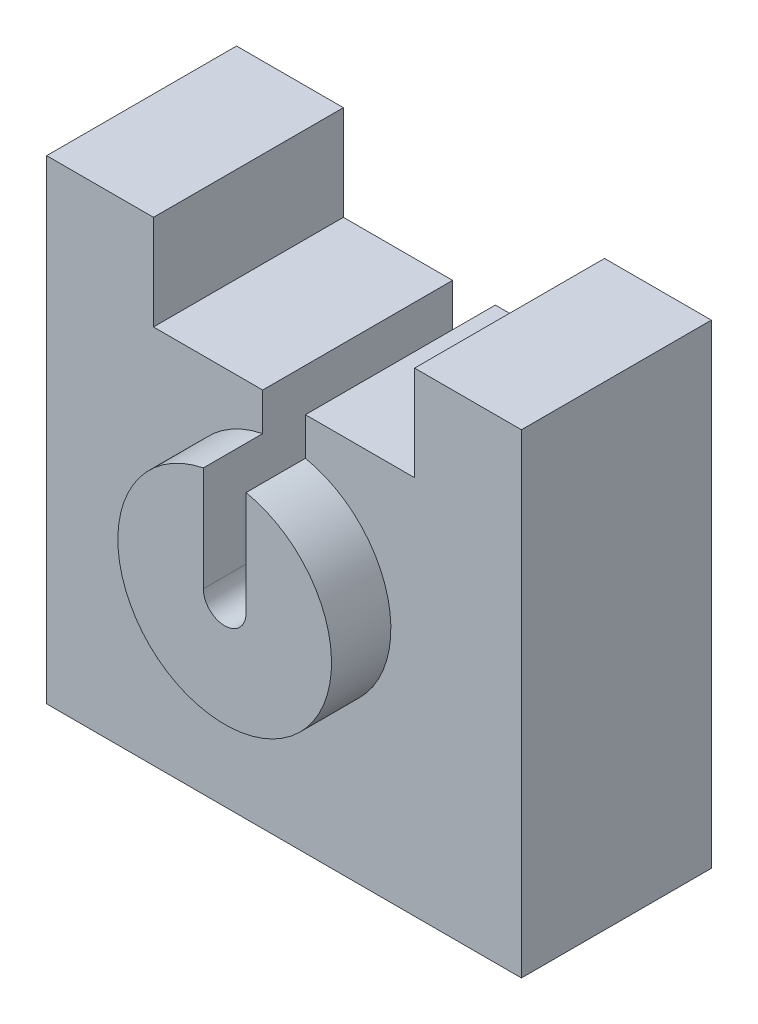
from build123d import *

# Parameters (mm, degrees)
BOSS_EXTRUDE1_DEPTH = 0.4
SKETCH2_R           = 0.225
BOSS_EXTRUDE2_DEPTH = 0.525
SKETCH3_R           = 0.045
CUT_EXTRUDE1_DEPTH  = 1.880695748
SKETCH5_W           = 0.09
SKETCH5_H           = 0.5
CUT_EXTRUDE2_DEPTH  = 1.880695748


with BuildPart() as part:
    # Sketch1 → Boss-Extrude1 (new body)
    with BuildSketch(Plane.XY):
        Polygon((0.275, 0.5), (0.5, 0.5), (0.5, -0.5), (-0.5, -0.5), (-0.5, 0.5), (-0.275, 0.5), (-0.275, 0.3), (0.275, 0.3), align=None)
    extrude(amount=BOSS_EXTRUDE1_DEPTH)

    # Sketch2 → Boss-Extrude2 (add)
    with BuildSketch(Plane(origin=(0, 0, 0), x_dir=(-1, 0, 0), z_dir=(0, 0, -1))):
        Circle(SKETCH2_R)
    extrude(amount=-BOSS_EXTRUDE2_DEPTH)

    # Sketch3 → Cut-Extrude1 (cut, through all)
    with BuildSketch(Plane.XY):
        Circle(SKETCH3_R)
    extrude(amount=CUT_EXTRUDE1_DEPTH, mode=Mode.SUBTRACT)

    # Sketch5 → Cut-Extrude2 (cut, through all)
    with BuildSketch(Plane(origin=(0, 0, 0), x_dir=(-1, 0, 0), z_dir=(0, 0, -1))):
        with Locations((0, 0.25)):
            Rectangle(SKETCH5_W, SKETCH5_H)
    extrude(amount=-CUT_EXTRUDE2_DEPTH, mode=Mode.SUBTRACT)


solid = part.part
